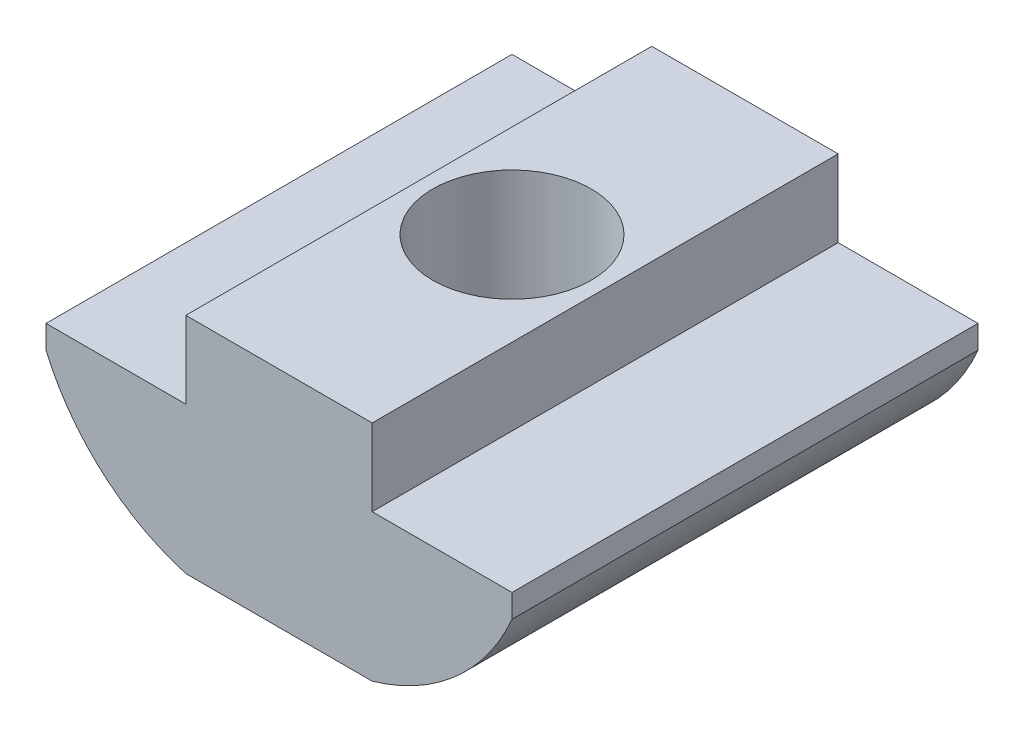
from build123d import *

# Parameters (mm, degrees)
EXTRUDE_1_DEPTH        = 10
HOLE_WIZARD_M8_1_D     = 6.8
HOLE_WIZARD_M8_1_DEPTH = 19.75
HOLE_WIZARD_M8_1_TIP   = 2.042926105


with BuildPart() as part:
    # 草图1 → 凸台-拉伸1 (new, symmetric)
    with BuildSketch(Plane.XY):
        with BuildLine():
            Line((4, -9.6), (-4, -9.6))
            ThreePointArc((-4, -9.6), (-7.592990245, -7.621309711), (-10, -4.3))
            Line((-10, -4.3), (-10, -3.3))
            Line((-10, -3.3), (-4, -3.3))
            Line((-4, -3.3), (-4, 0))
            Line((-4, 0), (4, 0))
            Line((4, 0), (4, -3.3))
            Line((4, -3.3), (10, -3.3))
            Line((10, -3.3), (10, -4.3))
            ThreePointArc((10, -4.3), (7.592990245, -7.621309711), (4, -9.6))
        make_face()
    extrude(amount=EXTRUDE_1_DEPTH, both=True)

    # M8 螺纹孔1
    with Locations(Plane.ZX):
        with Locations((0, 0)):
            Hole(HOLE_WIZARD_M8_1_D / 2, depth=HOLE_WIZARD_M8_1_DEPTH)
            with Locations((0, 0, -(HOLE_WIZARD_M8_1_DEPTH + HOLE_WIZARD_M8_1_TIP / 2))):  # 118° drill point
                Cone(0, HOLE_WIZARD_M8_1_D / 2, HOLE_WIZARD_M8_1_TIP, mode=Mode.SUBTRACT)


solid = part.part
